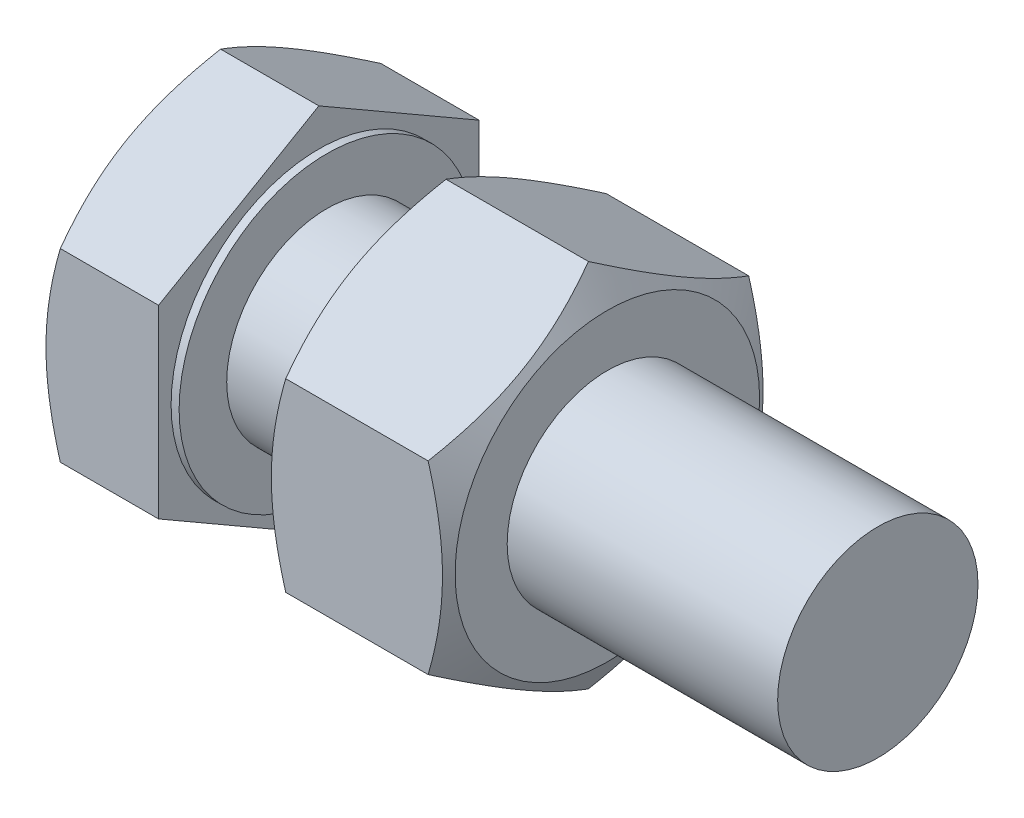
from build123d import *

# Parameters (mm, degrees)
BOLTHEAD_DEPTH                       = 12.5
UNBOLTHEADSK_W                       = 0.8
UNBOLTHEADSK_H                       = 3.725208614
BOLTBODYSK_R                         = 10
BOLTBODY_DEPTH                       = 55
BOLTHCSK_OUTSIDE_W                   = 302.814
BOLTHCSK_OUTSIDE_H                   = 307.764
BOLTHCSK_OUTSIDE_R                   = 15.2
BOLTHEADCHAMFER_DEPTH                = 72.788462397
BOLTHEADCHAMFER_DRAFT                = -60
NUTHEADSK_R                          = 10
NUTHEAD_DEPTH                        = 18
NUTHCSK_OUTSIDE_W                    = 217.994
NUTHCSK_OUTSIDE_H                    = 222.944
NUTHCSK_OUTSIDE_R                    = 15.2
NUTHEADCHAMFER_DEPTH                 = 48.303100674
NUTHEADCHAMFER_DRAFT                 = -60
NUTHEADCHAMFERMIRROR_COPY_1_SKETCH_W = 217.994
NUTHEADCHAMFERMIRROR_COPY_1_SKETCH_H = 222.944
NUTHEADCHAMFERMIRROR_COPY_1_SKETCH_R = 15.2
NUTHEADCHAMFERMIRROR_COPY_1_DEPTH    = 48.303100674
NUTHEADCHAMFERMIRROR_COPY_1_DRAFT    = -60


with BuildPart() as part:
    # BoltHeadSk → BoltHead (new body)
    with BuildSketch(Plane(origin=(0, 0, 0), x_dir=(0, 0, -1), z_dir=(1, 0, 0))):
        Polygon((0, 18.475208614), (-16, 9.237604307), (-16, -9.237604307), (0, -18.475208614), (16, -9.237604307), (16, 9.237604307), align=None)
    extrude(amount=-BOLTHEAD_DEPTH)

    # UnBoltHeadSk → UNBoltHead (revolve, cut)
    with BuildSketch(Plane.XY, mode=Mode.PRIVATE) as unbolthead_sk:
        with Locations((-0.4, 16.612604307)):
            Rectangle(UNBOLTHEADSK_W, UNBOLTHEADSK_H)
    revolve(unbolthead_sk.sketch.rotate(Axis((0, 0, 0), (-1, 0, 0)), 90), axis=Axis((0, 0, 0), (-1, 0, 0)), mode=Mode.SUBTRACT)

    # BoltBodySk → BoltBody (add)
    with BuildSketch(Plane(origin=(0, 0, 0), x_dir=(0, 0, -1), z_dir=(1, 0, 0))):
        Circle(BOLTBODYSK_R)
    extrude(amount=BOLTBODY_DEPTH)


with BuildPart() as boltheadchamfer_tool:
    # BoltHCSk outside → BoltHeadChamfer (with draft: the straight prism first)
    with BuildSketch(Plane.ZY.offset(12.5)):
        Rectangle(BOLTHCSK_OUTSIDE_W, BOLTHCSK_OUTSIDE_H)
        Circle(BOLTHCSK_OUTSIDE_R, mode=Mode.SUBTRACT)
    extrude(amount=-BOLTHEADCHAMFER_DEPTH)
    # BoltHeadChamfer: the draft: its side faces are tilted about the plane it starts from
    boltheadchamfer_sides = [boltheadchamfer_tool.faces().sort_by_distance(p)[0] for p in [
        (23.894231199, -153.882, 0),
        (23.894231199, 0, 151.407),
        (23.894231199, 153.882, 0),
        (23.894231199, 0, -151.407),
        (23.894231199, 0, -15.2),
    ]]
    draft(boltheadchamfer_sides, Plane.ZY.offset(12.5), BOLTHEADCHAMFER_DRAFT)


with BuildPart() as part_1:
    add(part.part)

    # BoltHeadChamfer: cut by boltheadchamfer_tool
    add(boltheadchamfer_tool.part, mode=Mode.SUBTRACT)


with BuildPart() as body_2:
    # NutHeadSk → NutHead (new body)
    with BuildSketch(Plane(origin=(10, 0, 0), x_dir=(0, 0, -1), z_dir=(1, 0, 0))):
        Polygon((-16, 9.237604307), (-16, -9.237604307), (0, -18.475208614), (16, -9.237604307), (16, 9.237604307), (0, 18.475208614), align=None)
        Circle(NUTHEADSK_R, mode=Mode.SUBTRACT)
    extrude(amount=NUTHEAD_DEPTH)


with BuildPart() as nutheadchamfer_tool:
    # NutHCSk outside → NutHeadChamfer (with draft: the straight prism first)
    with BuildSketch(Plane(origin=(28, 0, 0), x_dir=(0, 0, -1), z_dir=(1, 0, 0))):
        Rectangle(NUTHCSK_OUTSIDE_W, NUTHCSK_OUTSIDE_H)
        Circle(NUTHCSK_OUTSIDE_R, mode=Mode.SUBTRACT)
    extrude(amount=-NUTHEADCHAMFER_DEPTH)
    # NutHeadChamfer: the draft: its side faces are tilted about the plane it starts from
    nutheadchamfer_sides = [nutheadchamfer_tool.faces().sort_by_distance(p)[0] for p in [
        (3.848449663, -111.472, 0),
        (3.848449663, 0, -108.997),
        (3.848449663, 111.472, 0),
        (3.848449663, 0, 108.997),
        (3.848449663, 0, 15.2),
    ]]
    draft(nutheadchamfer_sides, Plane(origin=(28, 0, 0), x_dir=(0, 0, -1), z_dir=(1, 0, 0)), NUTHEADCHAMFER_DRAFT)


with BuildPart() as body_2_1:
    add(body_2.part)

    # NutHeadChamfer: cut by nutheadchamfer_tool
    add(nutheadchamfer_tool.part, mode=Mode.SUBTRACT)


with BuildPart() as nutheadchamfermirror_copy_1_tool:
    # NutHeadChamferMirror copy 1 sketch → NutHeadChamferMirror copy 1 (with draft: the straight prism first)
    with BuildSketch(Plane(origin=(10, 0, 0), x_dir=(0, 0, -1), z_dir=(-1, 0, 0))):
        Rectangle(NUTHEADCHAMFERMIRROR_COPY_1_SKETCH_W, NUTHEADCHAMFERMIRROR_COPY_1_SKETCH_H)
        Circle(NUTHEADCHAMFERMIRROR_COPY_1_SKETCH_R, mode=Mode.SUBTRACT)
    extrude(amount=-NUTHEADCHAMFERMIRROR_COPY_1_DEPTH)
    # NutHeadChamferMirror copy 1: the draft: its side faces are tilted about the plane it starts from
    nutheadchamfermirror_copy_1_sides = [nutheadchamfermirror_copy_1_tool.faces().sort_by_distance(p)[0] for p in [
        (34.151550337, -111.472, 0),
        (34.151550337, 0, -108.997),
        (34.151550337, 111.472, 0),
        (34.151550337, 0, 108.997),
        (34.151550337, 0, 15.2),
    ]]
    draft(nutheadchamfermirror_copy_1_sides, Plane(origin=(10, 0, 0), x_dir=(0, 0, -1), z_dir=(-1, 0, 0)), NUTHEADCHAMFERMIRROR_COPY_1_DRAFT)


with BuildPart() as body_2_2:
    add(body_2_1.part)

    # NutHeadChamferMirror copy 1: cut by nutheadchamfermirror_copy_1_tool
    add(nutheadchamfermirror_copy_1_tool.part, mode=Mode.SUBTRACT)


solid = Compound([part_1.part, body_2_2.part])
